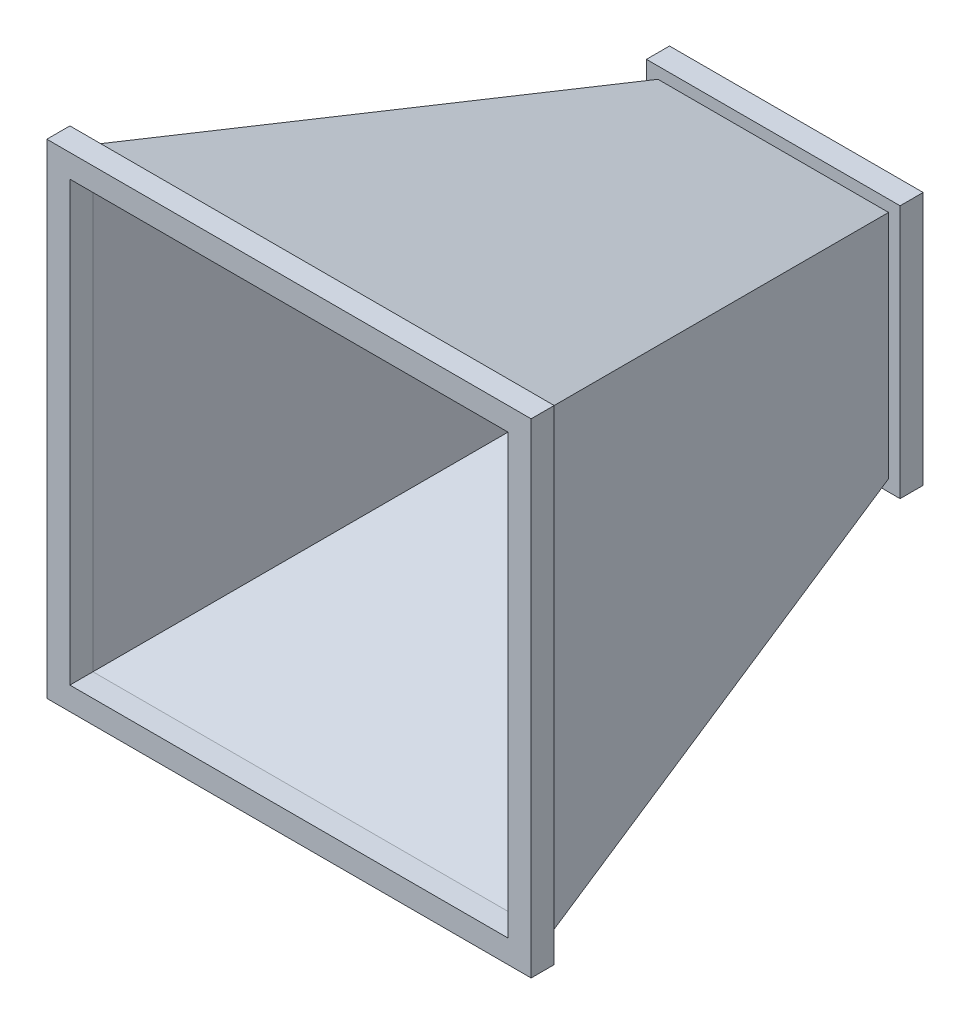
from build123d import *

# Parameters (mm, degrees)
SKETCH5_W           = 533.4
SKETCH5_H           = 533.4
SKETCH5_W_2         = 482.6
SKETCH5_H_2         = 482.6
BOSS_EXTRUDE1_DEPTH = 25.4
SKETCH6_W           = 279.4
SKETCH6_H           = 279.4
SKETCH6_W_2         = 228.6
SKETCH6_H_2         = 228.6
BOSS_EXTRUDE2_DEPTH = 25.4


with BuildPart() as part:
    # Sketch2 → Loft1 section 0
    with BuildSketch(Plane.XY.offset(508)):
        with BuildLine():
            Line((-254, -254), (254, -254))
            Line((254, -254), (254, 254))
            Line((254, 254), (-254, 254))
            Line((-254, 254), (-254, -254))
        make_face()
    # Sketch1 → Loft1 section 1
    with BuildSketch(Plane.XY):
        with BuildLine():
            Line((-127, -127), (127, -127))
            Line((127, -127), (127, 127))
            Line((127, 127), (-127, 127))
            Line((-127, 127), (-127, -127))
        make_face()
    loft()

    # Sketch4 → Cut-Loft1 section 0
    with BuildSketch(Plane(origin=(0, 0, 0), x_dir=(-1, 0, 0), z_dir=(0, 0, -1))):
        with BuildLine():
            Line((114.3, -114.3), (114.3, 114.3))
            Line((114.3, 114.3), (-114.3, 114.3))
            Line((-114.3, 114.3), (-114.3, -114.3))
            Line((-114.3, -114.3), (114.3, -114.3))
        make_face()
    # Sketch3 → Cut-Loft1 section 1
    with BuildSketch(Plane.XY.offset(508)):
        with BuildLine():
            Line((241.3, -241.3), (241.3, 241.3))
            Line((241.3, 241.3), (-241.3, 241.3))
            Line((-241.3, 241.3), (-241.3, -241.3))
            Line((-241.3, -241.3), (241.3, -241.3))
        make_face()
    loft(mode=Mode.SUBTRACT)

    # Sketch5 → Boss-Extrude1 (add)
    with BuildSketch(Plane.XY.offset(508)):
        Rectangle(SKETCH5_W, SKETCH5_H)
        Rectangle(SKETCH5_W_2, SKETCH5_H_2, mode=Mode.SUBTRACT)
    extrude(amount=BOSS_EXTRUDE1_DEPTH)

    # Sketch6 → Boss-Extrude2 (add)
    with BuildSketch(Plane(origin=(0, 0, 0), x_dir=(-1, 0, 0), z_dir=(0, 0, -1))):
        Rectangle(SKETCH6_W, SKETCH6_H)
        Rectangle(SKETCH6_W_2, SKETCH6_H_2, mode=Mode.SUBTRACT)
    extrude(amount=BOSS_EXTRUDE2_DEPTH)


solid = part.part
